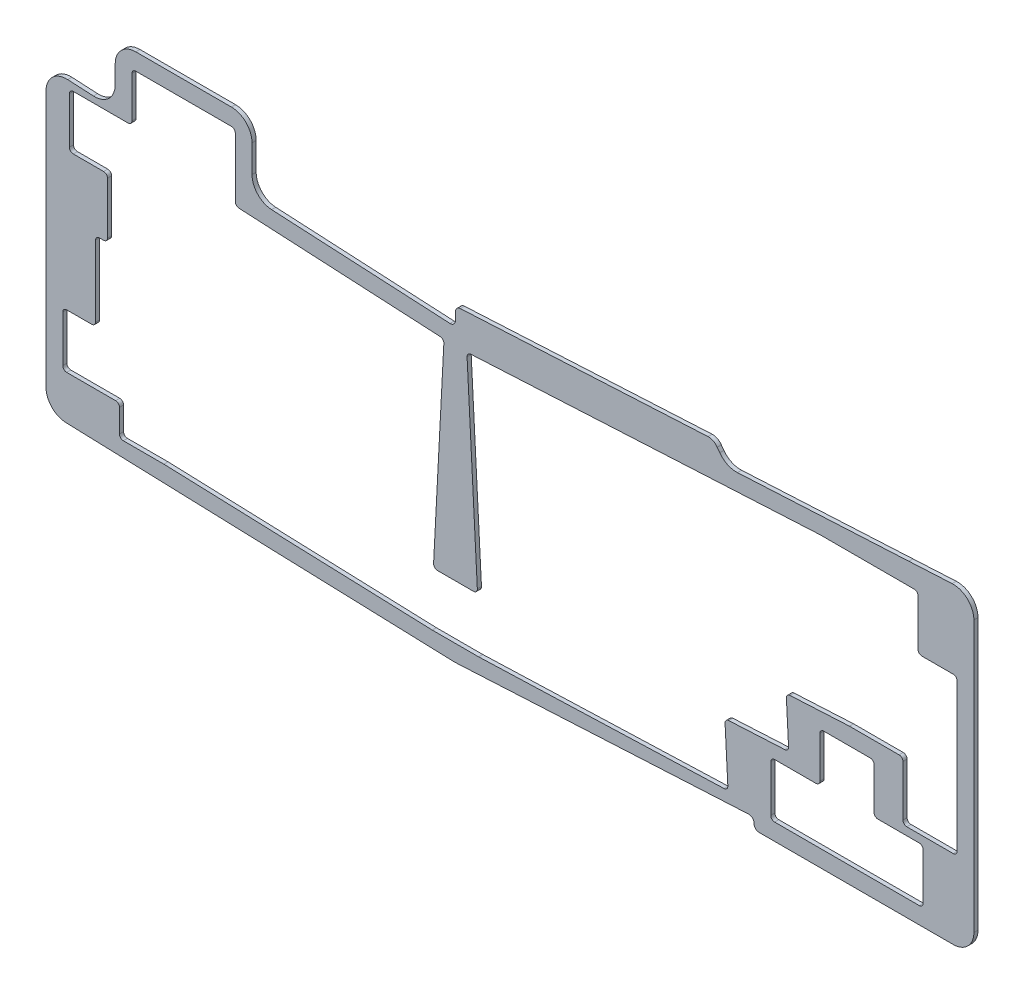
from build123d import *

# Parameters (mm, degrees)
ESTRUSIONE_ESTRUSIONE1_DEPTH = 1.6


with BuildPart() as part:
    # bordo3 → Estrusione-Estrusione1 (new body)
    with BuildSketch(Plane.XY):
        with BuildLine():
            Line((192.58131235, 105.882892913), (175.787012069, 105.00274093))
            Line((175.787012069, 105.00274093), (109.326285673, 101.536231916))
            ThreePointArc((109.326285673, 101.536231916), (105.496696561, 102.289889033), (102.479467612, 104.76578913))
            Line((102.479467612, 104.76578913), (101.477166344, 106.11988089))
            ThreePointArc((101.477166344, 106.11988089), (99.939463207, 107.499136975), (97.91868765, 107.927324355))
            Line((97.91868765, 107.927324355), (1.895328088, 102.894953321))
            ThreePointArc((1.895328088, 102.894953321), (0.549251258, 102.274403403), (0, 100.897694252))
            Line((0, 100.897694252), (0, 97.897694252))
            ThreePointArc((0, 97.897694252), (-0.623290849, 96.44694551), (-2.104671912, 95.900435182))
            Line((-2.104671912, 95.900435182), (-71.289889089, 99.526278774))
            ThreePointArc((-71.289889089, 99.526278774), (-76.674196407, 102.008478446), (-78.871201439, 107.515315052))
            Line((-78.871201439, 107.515315052), (-78.871201439, 118.187089821))
            ThreePointArc((-78.871201439, 118.187089821), (-81.214347189, 123.843944071), (-86.871201439, 126.187089821))
            Line((-86.871201439, 126.187089821), (-123.921201439, 126.187089821))
            ThreePointArc((-123.921201439, 126.187089821), (-129.578055688, 123.843944071), (-131.921201439, 118.187089821))
            Line((-131.921201439, 118.187089821), (-131.921201439, 111.134072211))
            ThreePointArc((-131.921201439, 111.134072211), (-134.414364833, 105.331077243), (-140.339889089, 103.145035933))
            Line((-140.339889089, 103.145035933), (-150.335746034, 103.668896598))
            ThreePointArc((-150.335746034, 103.668896598), (-156.26127029, 101.482855288), (-158.754433684, 95.67986032))
            Line((-158.754433684, 95.67986032), (-158.754433684, -3.865947122))
            ThreePointArc((-158.754433684, -3.865947122), (-156.505538032, -9.426954116), (-151.023233988, -11.861429997))
            Line((-151.023233988, -11.861429997), (-139.525733684, -12.247964697))
            Line((-139.525733684, -12.247964697), (-1.219558299, -16.897682863))
            ThreePointArc((-1.219558299, -16.897682863), (-0.145141858, -16.910699844), (0.928841556, -16.877537249))
            Line((0.928841556, -16.877537249), (113.64611863, -10.970275071))
            ThreePointArc((113.64611863, -10.970275071), (115.127499694, -11.516785399), (115.750790543, -12.967534141))
            Line((115.750790543, -12.967534141), (115.750790543, -13.091597346))
            ThreePointArc((115.750790543, -13.091597346), (116.336576981, -14.505810909), (117.750790543, -15.091597346))
            Line((117.750790543, -15.091597346), (193, -15.091597346))
            ThreePointArc((193, -15.091597346), (198.656854249, -12.748451596), (201, -7.091597346))
            Line((201, -7.091597346), (201, 97.893856635))
            ThreePointArc((201, 97.893856635), (198.506836606, 103.696851603), (192.58131235, 105.882892913))
        make_face()
        with BuildLine():
            ThreePointArc((4.502055698, 88.015097974), (4.885282762, 89.097297818), (5.921496066, 89.591546211))
            Line((5.921496066, 89.591546211), (141.282050751, 96.685492285))
            Line((141.282050751, 96.685492285), (177.852024899, 96.679778694))
            ThreePointArc((177.852024899, 96.679778694), (178.912533569, 96.240356024), (179.351790543, 95.179778713))
            Line((179.351790543, 95.179778713), (179.351790543, 77.179309781))
            ThreePointArc((179.351790543, 77.179309781), (179.791047517, 76.11873247), (180.851556187, 75.6793098))
            Line((180.851556187, 75.6793098), (193.000234356, 75.677411724))
            ThreePointArc((193.000234356, 75.677411724), (194.060743026, 75.237989054), (194.5, 74.177411743))
            Line((194.5, 74.177411743), (194.5, 16.9505))
            ThreePointArc((194.5, 16.9505), (194.060660172, 15.889839828), (193, 15.4505))
            Line((193, 15.4505), (175, 15.4505))
            ThreePointArc((175, 15.4505), (173.939339828, 15.889839828), (173.5, 16.9505))
            Line((173.5, 16.9505), (173.5, 36.605240872))
            ThreePointArc((173.5, 36.605240872), (173.060660172, 37.665901044), (172, 38.105240872))
            Line((172, 38.105240872), (152.727925239, 38.105240872))
            Line((152.727925239, 38.105240872), (129.729835534, 36.899962063))
            ThreePointArc((129.729835534, 36.899962063), (128.69362223, 36.405713671), (128.310395167, 35.323513827))
            Line((128.310395167, 35.323513827), (129.150382031, 19.295609657))
            ThreePointArc((129.150382031, 19.295609657), (128.767154967, 18.213409813), (127.730941663, 17.71916142))
            Line((127.730941663, 17.71916142), (105.950202838, 16.577681267))
            ThreePointArc((105.950202838, 16.577681267), (104.913989534, 16.083432875), (104.53076247, 15.001233031))
            Line((104.53076247, 15.001233031), (105.60810129, -5.555616249))
            ThreePointArc((105.60810129, -5.555616249), (105.216302409, -6.647255074), (104.163185056, -7.133182565))
            Line((104.163185056, -7.133182565), (9, -10.4995))
            Line((9, -10.4995), (-9, -10.4995))
            Line((-9, -10.4995), (-113.037709318, -6.819253752))
            Line((-113.037709318, -6.819253752), (-128.763233684, -6.819253752))
            ThreePointArc((-128.763233684, -6.819253752), (-129.823893856, -6.379913923), (-130.263233684, -5.319253752))
            Line((-130.263233684, -5.319253752), (-130.263233684, 3.650335982))
            ThreePointArc((-130.263233684, 3.650335982), (-130.702573513, 4.710996153), (-131.763233684, 5.150335982))
            Line((-131.763233684, 5.150335982), (-150.754433684, 5.150335982))
            ThreePointArc((-150.754433684, 5.150335982), (-151.815093856, 5.58967581), (-152.254433684, 6.650335982))
            Line((-152.254433684, 6.650335982), (-152.254433684, 24.649335982))
            ThreePointArc((-152.254433684, 24.649335982), (-151.815093856, 25.709996153), (-150.754433684, 26.149335982))
            Line((-150.754433684, 26.149335982), (-141.025733684, 26.149335982))
            ThreePointArc((-141.025733684, 26.149335982), (-139.965073513, 26.58867581), (-139.525733684, 27.649335982))
            Line((-139.525733684, 27.649335982), (-139.525733684, 55.176535982))
            ThreePointArc((-139.525733684, 55.176535982), (-139.086393856, 56.237196153), (-138.025733684, 56.676535982))
            Line((-138.025733684, 56.676535982), (-136.394433684, 56.676535982))
            ThreePointArc((-136.394433684, 56.676535982), (-135.333773513, 57.11587581), (-134.894433684, 58.176535982))
            Line((-134.894433684, 58.176535982), (-134.894433684, 78.277535982))
            ThreePointArc((-134.894433684, 78.277535982), (-135.333773513, 79.338196153), (-136.394433684, 79.777535982))
            Line((-136.394433684, 79.777535982), (-148.181933684, 79.777535982))
            ThreePointArc((-148.181933684, 79.777535982), (-149.242593856, 80.21687581), (-149.681933684, 81.277535982))
            Line((-149.681933684, 81.277535982), (-149.681933684, 99.276535982))
            ThreePointArc((-149.681933684, 99.276535982), (-149.242593856, 100.337196153), (-148.181933684, 100.776535982))
            Line((-148.181933684, 100.776535982), (-126.921201439, 100.776535982))
            ThreePointArc((-126.921201439, 100.776535982), (-125.860541267, 101.21587581), (-125.421201439, 102.276535982))
            Line((-125.421201439, 102.276535982), (-125.421201439, 118.187089821))
            ThreePointArc((-125.421201439, 118.187089821), (-124.981861611, 119.247749993), (-123.921201439, 119.687089821))
            Line((-123.921201439, 119.687089821), (-86.871201439, 119.687089821))
            ThreePointArc((-86.871201439, 119.687089821), (-85.810541267, 119.247749993), (-85.371201439, 118.187089821))
            Line((-85.371201439, 118.187089821), (-85.371201439, 95.178775684))
            ThreePointArc((-85.371201439, 95.178775684), (-84.959262995, 94.146243821), (-83.949705373, 93.680831382))
            Line((-83.949705373, 93.680831382), (-13.061697239, 89.965748298))
            Line((-13.061697239, 89.965748298), (-5.921496066, 89.591546211))
            ThreePointArc((-5.921496066, 89.591546211), (-4.885282762, 89.097297818), (-4.502055698, 88.015097975))
            Line((-4.502055698, 88.015097975), (-8.481750162, 12.078003934))
            ThreePointArc((-8.481750162, 12.078003934), (-8.071867416, 10.966968136), (-6.98380586, 10.4995))
            Line((-6.98380586, 10.4995), (6.98380586, 10.4995))
            ThreePointArc((6.98380586, 10.4995), (8.071867416, 10.966968136), (8.481750162, 12.078003934))
            Line((8.481750162, 12.078003934), (4.502055698, 88.015097974))
        make_face(mode=Mode.SUBTRACT)
        with BuildLine():
            ThreePointArc((123.750790543, -8.591597346), (122.690130371, -8.152257518), (122.250790543, -7.091597346))
            Line((122.250790543, -7.091597346), (122.250790543, 10.907402654))
            ThreePointArc((122.250790543, 10.907402654), (122.690130371, 11.968062825), (123.750790543, 12.407402654))
            Line((123.750790543, 12.407402654), (139.800790543, 12.407402654))
            ThreePointArc((139.800790543, 12.407402654), (140.861450715, 12.846742482), (141.300790543, 13.907402654))
            Line((141.300790543, 13.907402654), (141.300790543, 29.957402654))
            ThreePointArc((141.300790543, 29.957402654), (141.740130371, 31.018062825), (142.800790543, 31.457402654))
            Line((142.800790543, 31.457402654), (160.800790543, 31.457402654))
            ThreePointArc((160.800790543, 31.457402654), (161.861450715, 31.018062825), (162.300790543, 29.957402654))
            Line((162.300790543, 29.957402654), (162.300790543, 13.907402654))
            ThreePointArc((162.300790543, 13.907402654), (162.740130371, 12.846742482), (163.800790543, 12.407402654))
            Line((163.800790543, 12.407402654), (179.850790543, 12.407402654))
            ThreePointArc((179.850790543, 12.407402654), (180.911450715, 11.968062825), (181.350790543, 10.907402654))
            Line((181.350790543, 10.907402654), (181.350790543, -7.091597346))
            ThreePointArc((181.350790543, -7.091597346), (180.911450715, -8.152257518), (179.850790543, -8.591597346))
            Line((179.850790543, -8.591597346), (123.750790543, -8.591597346))
        make_face(mode=Mode.SUBTRACT)
    extrude(amount=ESTRUSIONE_ESTRUSIONE1_DEPTH)


solid = part.part
